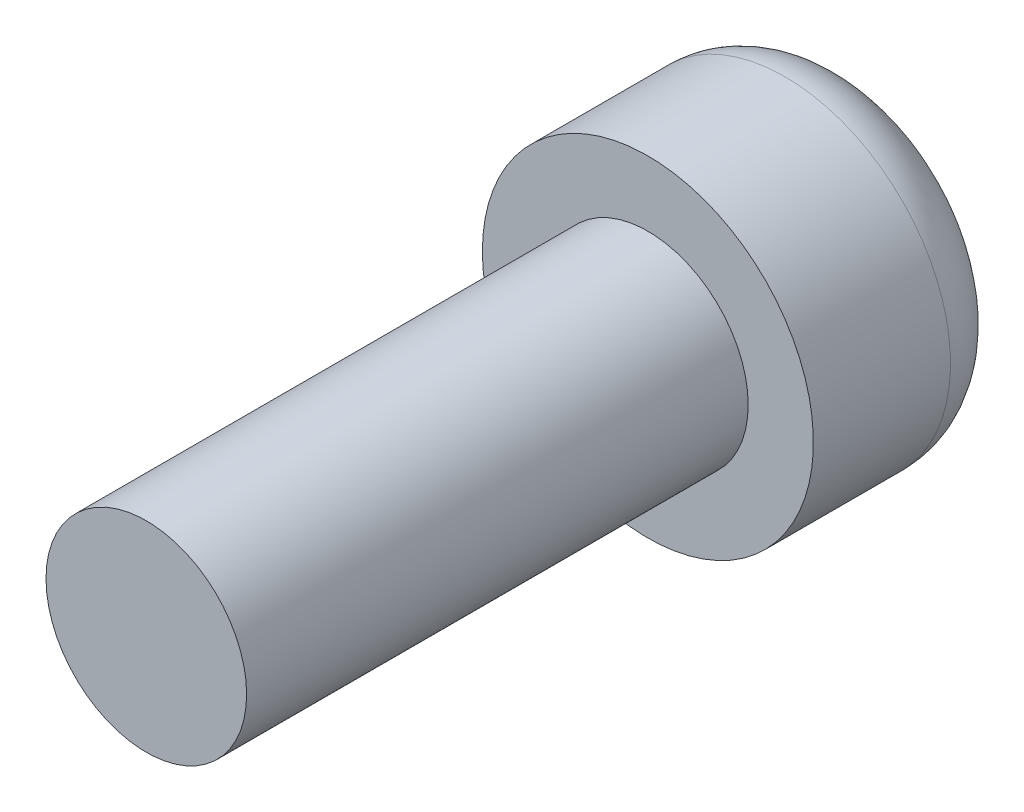
from build123d import *

# Parameters (mm, degrees)
SKETCH_1_R      = 3
EXTRUDE_1_DEPTH = 15
SKETCH_2_R      = 4.95
EXTRUDE_2_DEPTH = 6.1
FILLET_1_R      = 2


with BuildPart() as part:
    # 草图1 → 凸台-拉伸1 (new body)
    with BuildSketch(Plane.XY):
        Circle(SKETCH_1_R)
    extrude(amount=EXTRUDE_1_DEPTH)

    # 草图2 → 凸台-拉伸2 (add)
    with BuildSketch(Plane(origin=(0, 0, 0), x_dir=(-1, 0, 0), z_dir=(0, 0, -1))):
        Circle(SKETCH_2_R)
    extrude(amount=EXTRUDE_2_DEPTH)

    # 圆角1
    fillet_1_edges = [part.edges().sort_by_distance(p)[0] for p in [
        (4.95, 0, -6.1),
    ]]
    fillet(fillet_1_edges, radius=FILLET_1_R)


solid = part.part
